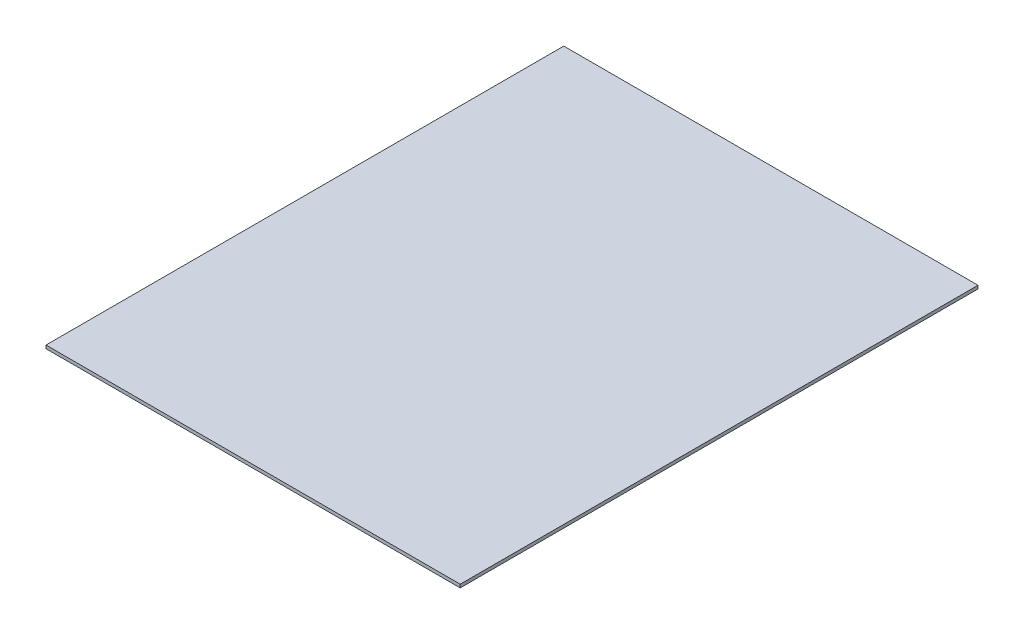
from build123d import *

# Parameters (mm, degrees)
SKETCH1_W           = 406.4
SKETCH1_H           = 508
BOSS_EXTRUDE1_DEPTH = 3.175


with BuildPart() as part:
    # Sketch1 → Boss-Extrude1 (new body)
    with BuildSketch(Plane(origin=(0, 0, 0), x_dir=(1, 0, 0), z_dir=(0, 1, 0))):
        with Locations((203.2, 254)):
            Rectangle(SKETCH1_W, SKETCH1_H)
    extrude(amount=BOSS_EXTRUDE1_DEPTH)


solid = part.part
